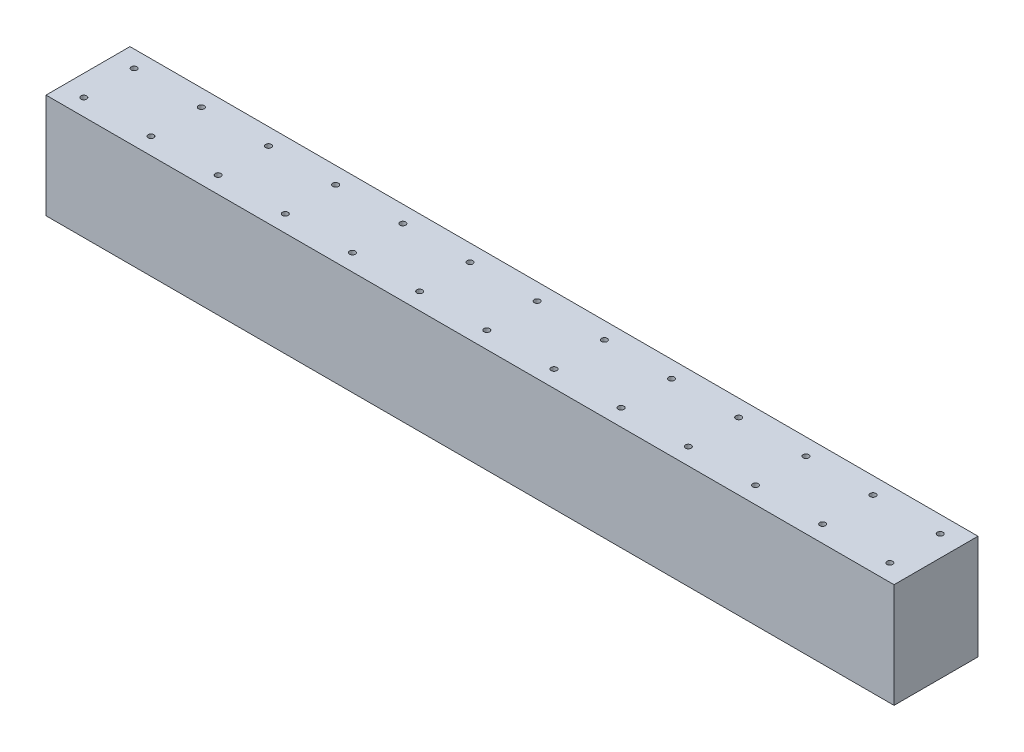
from build123d import *

# Parameters (mm, degrees)
SKETCH1_W             = 100
SKETCH1_H             = 124.5
BOSS_EXTRUDE1_DEPTH   = 505
M8_TAPPED_HOLE1_D     = 6.8
M8_TAPPED_HOLE1_DEPTH = 22.25
M8_TAPPED_HOLE1_TIP   = 2.042926105


with BuildPart() as part:
    # Sketch1 → Boss-Extrude1 (new, symmetric)
    with BuildSketch(Plane(origin=(0, 0, 0), x_dir=(0, 0, -1), z_dir=(1, 0, 0))):
        Rectangle(SKETCH1_W, SKETCH1_H)
    extrude(amount=BOSS_EXTRUDE1_DEPTH, both=True)

    # M8 Tapped Hole1
    with Locations(Plane(origin=(0, 62.25, 0), x_dir=(1, 0, 0), z_dir=(0, 1, 0))):
        with Locations((480, 30), (480, -30), (400, 30), (400, -30), (320, 30), (320, -30), (240, -30), (240, 30), (160, 30), (160, -30), (80, 30), (80, -30), (0, -30), (0, 30), (-80, -30), (-80, 30), (-160, -30), (-160, 30), (-240, -30), (-240, 30), (-320, -30), (-320, 30), (-400, -30), (-400, 30), (-480, 30), (-480, -30)):
            Hole(M8_TAPPED_HOLE1_D / 2, depth=M8_TAPPED_HOLE1_DEPTH)
            with Locations((0, 0, -(M8_TAPPED_HOLE1_DEPTH + M8_TAPPED_HOLE1_TIP / 2))):  # 118° drill point
                Cone(0, M8_TAPPED_HOLE1_D / 2, M8_TAPPED_HOLE1_TIP, mode=Mode.SUBTRACT)


solid = part.part
